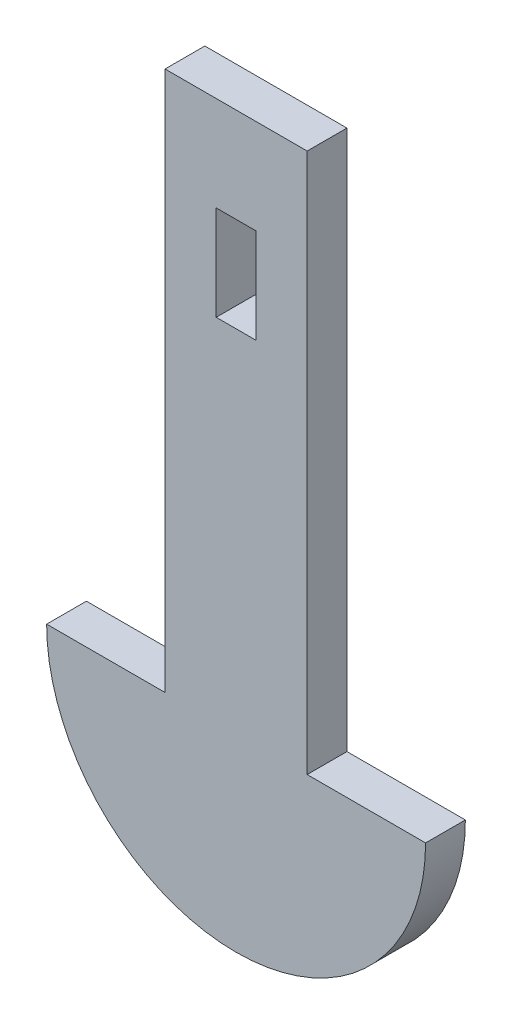
from build123d import *

# Parameters (mm, degrees)
SKETCH1_W           = 5.334
SKETCH1_H           = 12.7
BOSS_EXTRUDE1_DEPTH = 5.334


with BuildPart() as part:
    # Sketch1 → Boss-Extrude1 (new body)
    with BuildSketch(Plane.XY):
        with BuildLine():
            Line((-9.525, 0), (-25.4, 0))
            ThreePointArc((-25.4, 0), (0, -25.4), (25.4, 0))
            Line((25.4, 0), (9.525, 0))
            Line((9.525, 0), (9.525, 72.39))
            Line((9.525, 72.39), (-9.525, 72.39))
            Line((-9.525, 72.39), (-9.525, 0))
        make_face()
        with Locations((0, 53.34)):
            Rectangle(SKETCH1_W, SKETCH1_H, mode=Mode.SUBTRACT)
    extrude(amount=BOSS_EXTRUDE1_DEPTH)


solid = part.part
